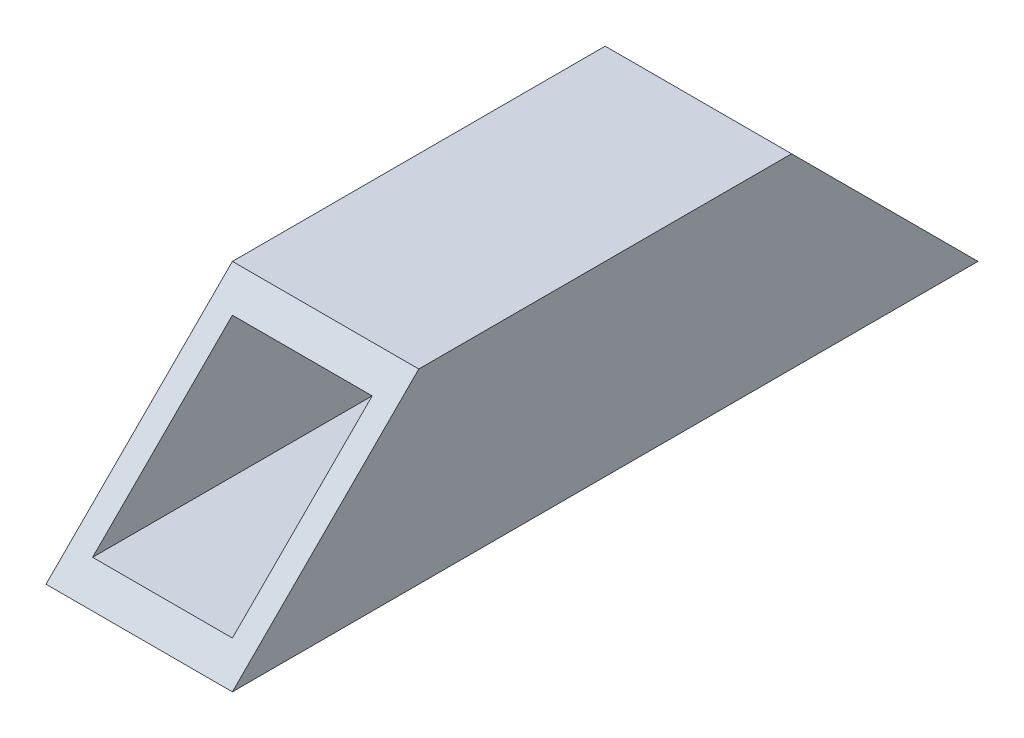
from build123d import *

# Parameters (mm, degrees)
SKETCH1_W           = 25.4
SKETCH1_H           = 25.4
SKETCH1_W_2         = 19.05
SKETCH1_H_2         = 19.05
BOSS_EXTRUDE1_DEPTH = 101.6
CUT_EXTRUDE1_REACH  = 107.494


with BuildPart() as part:
    # Sketch1 → Boss-Extrude1 (new body)
    with BuildSketch(Plane.XY):
        Rectangle(SKETCH1_W, SKETCH1_H)
        Rectangle(SKETCH1_W_2, SKETCH1_H_2, mode=Mode.SUBTRACT)
    extrude(amount=BOSS_EXTRUDE1_DEPTH)

    # Cut-Extrude1: up to this face of the body (flat: up to its plane)
    cut_extrude1_end = Plane(part.part.faces().sort_by_distance((-12.7, 0, 50.8))[0])
    # Sketch2 → Cut-Extrude1 (cut, up to the picked face)
    with BuildSketch(Plane(origin=(12.7, 0, 0), x_dir=(0, 0, -1), z_dir=(1, 0, 0)), mode=Mode.PRIVATE) as cut_extrude1_sk1:
        Polygon((-101.6, 12.7), (-101.6, -12.7), (-76.2, 12.7), align=None)
    cut_extrude1_tool1 = split(extrude(cut_extrude1_sk1.sketch, amount=-CUT_EXTRUDE1_REACH, mode=Mode.PRIVATE), bisect_by=cut_extrude1_end, keep=Keep.BOTH, mode=Mode.PRIVATE)
    # Sketch2 → Cut-Extrude1 (cut, up to the picked face)
    with BuildSketch(Plane(origin=(12.7, 0, 0), x_dir=(0, 0, -1), z_dir=(1, 0, 0)), mode=Mode.PRIVATE) as cut_extrude1_sk2:
        Polygon((-25.4, 12.7), (0, -12.7), (0, 12.7), align=None)
    cut_extrude1_tool2 = split(extrude(cut_extrude1_sk2.sketch, amount=-CUT_EXTRUDE1_REACH, mode=Mode.PRIVATE), bisect_by=cut_extrude1_end, keep=Keep.BOTH, mode=Mode.PRIVATE)
    add(cut_extrude1_tool1.solids().sort_by(Axis((12.7, 4.233333, 93.133333), (-1, 0, 0)))[0], mode=Mode.SUBTRACT)
    add(cut_extrude1_tool2.solids().sort_by(Axis((12.7, 4.233333, 8.466667), (-1, 0, 0)))[0], mode=Mode.SUBTRACT)


solid = part.part
